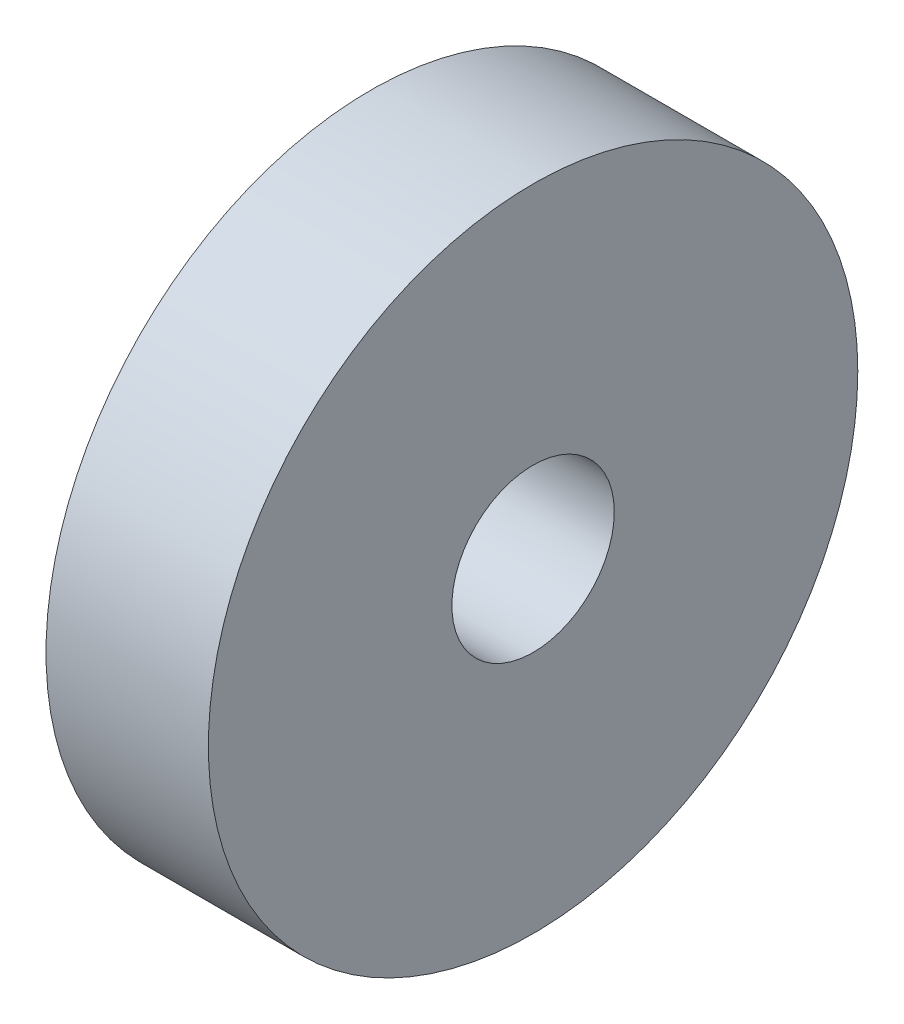
from build123d import *

# Parameters (mm, degrees)
SKETCH_1_R      = 100
SKETCH_1_R_2    = 25
EXTRUDE_1_DEPTH = 50


with BuildPart() as part:
    # 草图1 → 凸台-拉伸1 (new body)
    with BuildSketch(Plane(origin=(0, 0, 0), x_dir=(0, 0, -1), z_dir=(1, 0, 0))):
        Circle(SKETCH_1_R)
        Circle(SKETCH_1_R_2, mode=Mode.SUBTRACT)
    extrude(amount=EXTRUDE_1_DEPTH)


solid = part.part
